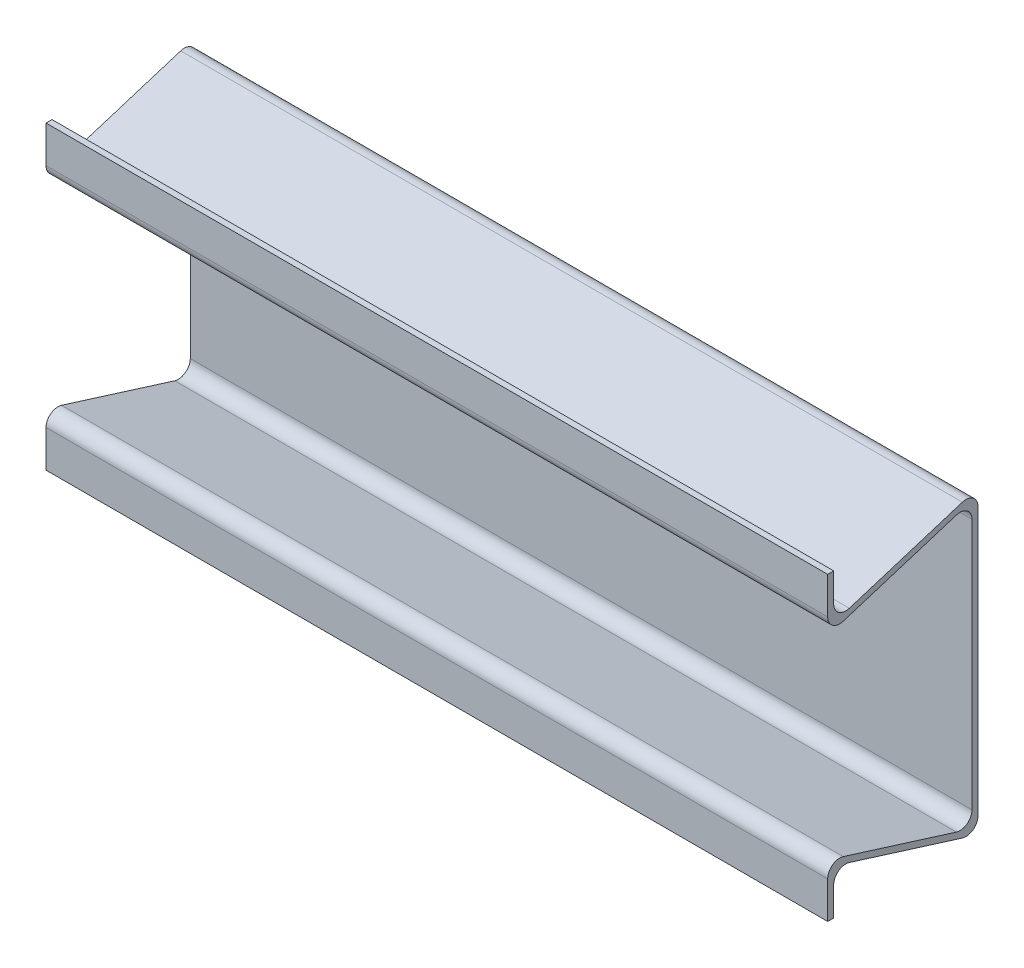
from build123d import *

# Parameters (mm, degrees)
SALIENTE_EXTRUIR1_DEPTH      = 130
SALIENTE_EXTRUIR1_DEPTH_BACK = 130
REDONDEO1_R                  = 4


with BuildPart() as part:
    # Croquis1 → Saliente-Extruir1 (new, two sides: drawn at the far end of the back side and taken through both)
    with BuildSketch(Plane(origin=(0, 0, 0), x_dir=(0, 0, -1), z_dir=(1, 0, 0)).offset(-SALIENTE_EXTRUIR1_DEPTH_BACK)):
        Polygon((50, 50), (2, 35), (2, 50), (0, 50), (0, 32.279618173), (48, 47.279618173), (48, 0), (48, -47.279618173), (0, -32.279618173), (0, -50), (2, -50), (2, -35), (50, -50), (50, 0), align=None)
    extrude(amount=SALIENTE_EXTRUIR1_DEPTH + SALIENTE_EXTRUIR1_DEPTH_BACK)

    # Redondeo1
    redondeo1_edges = [part.edges().sort_by_distance(p)[0] for p in [
        (0, -35, -2),
        (0, -32.279618173, 0),
        (0, -47.279618173, -48),
        (0, -50, -50),
        (0, 50, -50),
        (0, 47.279618173, -48),
        (0, 35, -2),
        (0, 32.279618173, 0),
    ]]
    fillet(redondeo1_edges, radius=REDONDEO1_R)


solid = part.part
